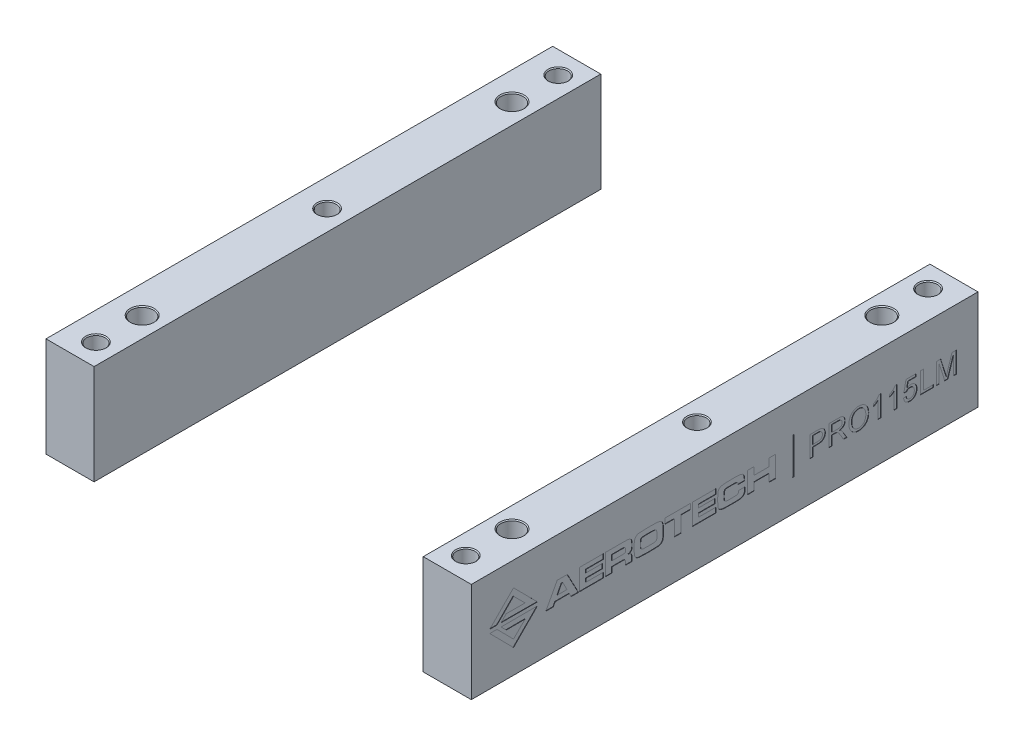
from build123d import *

# Parameters (mm, degrees)
SKETCH1_W                      = 13
SKETCH1_H                      = 27
EXTRUDE1_DEPTH                 = 68.5
EXTRUDE1_2_DEPTH               = 68.5
M5X0_8_TAPPED_HOLE1_AT_2_COUNT = 2
M5X0_8_TAPPED_HOLE1_AT_2_PITCH = 100
M5X0_8_TAPPED_HOLE1_AT_3_COUNT = 2
M5X0_8_TAPPED_HOLE1_AT_3_PITCH = 117.924764151
M5X0_8_TAPPED_HOLE1_AT_4_COUNT = 2
M5X0_8_TAPPED_HOLE1_AT_4_PITCH = 62.5
M5X0_8_TAPPED_HOLE1_AT_5_COUNT = 2
M5X0_8_TAPPED_HOLE1_AT_5_PITCH = 125
M5X0_8_TAPPED_HOLE1_AT_6_COUNT = 2
M5X0_8_TAPPED_HOLE1_AT_6_PITCH = 160.078105936
M6X1_0_TAPPED_HOLE1_AT_2_COUNT = 2
M6X1_0_TAPPED_HOLE1_AT_2_PITCH = 100
M6X1_0_TAPPED_HOLE1_AT_3_COUNT = 2
M6X1_0_TAPPED_HOLE1_AT_3_PITCH = 141.421356237
M6X1_0_TAPPED_HOLE1_AT_4_COUNT = 2
M6X1_0_TAPPED_HOLE1_AT_4_PITCH = 100
SKETCH8_W                      = 0.352777768
SKETCH8_H                      = 9.877777778
CUT_EXTRUDE1_DEPTH             = 0.1


with BuildPart() as part:
    # Sketch1 → Extrude1 (new, symmetric)
    with BuildSketch(Plane.XY):
        with Locations((-51, -23.5)):
            Rectangle(SKETCH1_W, SKETCH1_H)
    extrude(amount=EXTRUDE1_DEPTH, both=True)

    # Sketch3 → M5x0.8 Tapped Hole1 (revolve, cut)
    with BuildSketch(Plane(origin=(-50, -10, -62.5), x_dir=(0, 0, 1), z_dir=(1, 0, 0))):
        Polygon((0, 0), (0, 9.4618073), (2.1, 8.2), (2.1, 5.8), (2.5, 5.8), (2.5, 0.25), (2.75, 0), align=None)
    m5x0_8_tapped_hole1 = revolve(axis=Axis((-50, -3.65, -62.5), (0, -1, 0)), mode=Mode.SUBTRACT)

    # M5x0.8 Tapped Hole1 at 4: M5x0.8 Tapped Hole1 ×2
    with Locations(*[(0, 0, i * M5X0_8_TAPPED_HOLE1_AT_4_PITCH) for i in range(1, M5X0_8_TAPPED_HOLE1_AT_4_COUNT)]):
        add(m5x0_8_tapped_hole1, mode=Mode.SUBTRACT)

    # M5x0.8 Tapped Hole1 at 5: M5x0.8 Tapped Hole1 ×2
    with Locations(*[(0, 0, i * M5X0_8_TAPPED_HOLE1_AT_5_PITCH) for i in range(1, M5X0_8_TAPPED_HOLE1_AT_5_COUNT)]):
        add(m5x0_8_tapped_hole1, mode=Mode.SUBTRACT)

    # Sketch5 → M6x1.0 Tapped Hole1 (revolve, cut)
    with BuildSketch(Plane(origin=(-50, -10, -50), x_dir=(0, 0, 1), z_dir=(1, 0, 0))):
        Polygon((0, 0), (0, 11.502151548), (2.5, 10), (2.5, 7), (3, 7), (3, 0.25), (3.25, 0), align=None)
    m6x1_0_tapped_hole1 = revolve(axis=Axis((-50, -3.65, -50), (0, -1, 0)), mode=Mode.SUBTRACT)

    # M6x1.0 Tapped Hole1 at 4: M6x1.0 Tapped Hole1 ×2
    with Locations(*[(0, 0, i * M6X1_0_TAPPED_HOLE1_AT_4_PITCH) for i in range(1, M6X1_0_TAPPED_HOLE1_AT_4_COUNT)]):
        add(m6x1_0_tapped_hole1, mode=Mode.SUBTRACT)


with BuildPart() as body_2:
    # Sketch1 → Extrude1 2 (new, symmetric)
    with BuildSketch(Plane.XY):
        with Locations((51, -23.5)):
            Rectangle(SKETCH1_W, SKETCH1_H)
    extrude(amount=EXTRUDE1_2_DEPTH, both=True)

    # M5x0.8 Tapped Hole1 at 2: M5x0.8 Tapped Hole1 ×2
    with Locations(*[(i * M5X0_8_TAPPED_HOLE1_AT_2_PITCH, 0, 0) for i in range(1, M5X0_8_TAPPED_HOLE1_AT_2_COUNT)]):
        add(m5x0_8_tapped_hole1, mode=Mode.SUBTRACT)

    # M5x0.8 Tapped Hole1 at 3: M5x0.8 Tapped Hole1 ×2
    with Locations(*[Vector(0.847998304005088, 0, 0.5299989400031799) * (i * M5X0_8_TAPPED_HOLE1_AT_3_PITCH) for i in range(1, M5X0_8_TAPPED_HOLE1_AT_3_COUNT)]):
        add(m5x0_8_tapped_hole1, mode=Mode.SUBTRACT)

    # M5x0.8 Tapped Hole1 at 6: M5x0.8 Tapped Hole1 ×2
    with Locations(*[Vector(0.6246950475544243, 0, 0.7808688094430304) * (i * M5X0_8_TAPPED_HOLE1_AT_6_PITCH) for i in range(1, M5X0_8_TAPPED_HOLE1_AT_6_COUNT)]):
        add(m5x0_8_tapped_hole1, mode=Mode.SUBTRACT)

    # M6x1.0 Tapped Hole1 at 2: M6x1.0 Tapped Hole1 ×2
    with Locations(*[(i * M6X1_0_TAPPED_HOLE1_AT_2_PITCH, 0, 0) for i in range(1, M6X1_0_TAPPED_HOLE1_AT_2_COUNT)]):
        add(m6x1_0_tapped_hole1, mode=Mode.SUBTRACT)

    # M6x1.0 Tapped Hole1 at 3: M6x1.0 Tapped Hole1 ×2
    with Locations(*[Vector(0.7071067811865476, 0, 0.7071067811865476) * (i * M6X1_0_TAPPED_HOLE1_AT_3_PITCH) for i in range(1, M6X1_0_TAPPED_HOLE1_AT_3_COUNT)]):
        add(m6x1_0_tapped_hole1, mode=Mode.SUBTRACT)

    # Sketch8 → Cut-Extrude1 (cut)
    # profile 1 of 19: a face of its own
    with BuildSketch(Plane(origin=(57.5, 0, 0), x_dir=(0, 0, -1), z_dir=(1, 0, 0))):
        with BuildLine():
            Line((23.025857141, -26.353231317), (23.025857141, -20.70293021))
            Line((23.025857141, -20.70293021), (25.101708949, -20.70293021))
            add(Edge.make_bspline(
                [(25.101708949, -20.70293021), (25.187751334, -20.703420401), (25.349339335, -20.704340981), (25.574994903, -20.715122157), (25.768769004, -20.728460256), (25.885809339, -20.747450241), (25.939293649, -20.756128157)],
                knots=[0, 0, 0, 0, 1.22865052, 2.30741144, 3.226532197, 4, 4, 4, 4], degree=3))
            add(Edge.make_bspline(
                [(25.939293649, -20.756128157), (26.004531595, -20.768683346), (26.130980921, -20.793018801), (26.310013567, -20.851686305), (26.473122678, -20.924693536), (26.620053347, -21.015653011), (26.753246546, -21.122508146), (26.87080412, -21.250545682), (26.975010036, -21.396906765), (27.063616896, -21.561476877), (27.137368531, -21.738554246), (27.189024464, -21.927202917), (27.222110181, -22.124145375), (27.225592673, -22.258740394), (27.227363092, -22.327165404)],
                knots=[0, 0, 0, 0, 1.070909925, 2.075721949, 3.031861647, 3.947440733, 4.85625699, 5.777986723, 6.742441087, 7.747548058, 8.78749499, 9.830146138, 10.896896232, 12, 12, 12, 12], degree=3))
            add(Edge.make_bspline(
                [(27.227363092, -22.327165404), (27.226115405, -22.385709817), (27.223660512, -22.500899157), (27.202580736, -22.670128921), (27.169333372, -22.832934836), (27.119740419, -22.988202793), (27.059111703, -23.137748029), (26.982705511, -23.279048428), (26.893484636, -23.414022729), (26.791120604, -23.542303655), (26.670609708, -23.661288096), (26.525620286, -23.762223001), (26.358947747, -23.846979948), (26.170553219, -23.915462645), (25.960894032, -23.969347492), (25.729283232, -24.008828152), (25.475269635, -24.030624763), (25.298695381, -24.033608928), (25.206972972, -24.035159068)],
                knots=[0, 0, 0, 0, 0.928769099, 1.82740408, 2.702266355, 3.562020322, 4.410419678, 5.259600434, 6.10654066, 6.975254961, 7.860221694, 8.783881459, 9.766664779, 10.81996744, 11.958551584, 13.197863772, 14.544415867, 16, 16, 16, 16], degree=3))
            Line((25.206972972, -24.035159068), (23.822694476, -24.035159068))
            Line((23.822694476, -24.035159068), (23.822694476, -26.353231317))
            Line((23.822694476, -26.353231317), (23.025857141, -26.353231317))
        make_face()
        with BuildLine():
            Line((23.822694476, -23.383201248), (25.185467419, -23.383201248))
            add(Edge.make_bspline(
                [(25.185467419, -23.383201248), (25.239820159, -23.382292449), (25.344525676, -23.380541733), (25.495820372, -23.368324286), (25.63467157, -23.347176448), (25.761464432, -23.317681405), (25.876360404, -23.281019913), (25.979153916, -23.234653217), (26.069314892, -23.17903373), (26.147440763, -23.114728221), (26.214503006, -23.042690361), (26.272610846, -22.964101033), (26.321982407, -22.878398625), (26.360683877, -22.785224567), (26.393469357, -22.686391276), (26.413933416, -22.579850919), (26.428162012, -22.467148488), (26.429726794, -22.389466487), (26.430525756, -22.349802828)],
                knots=[0, 0, 0, 0, 1.403696362, 2.704090955, 3.91683431, 5.027708188, 6.063065288, 7.026749679, 7.932587242, 8.790956304, 9.632005367, 10.468072405, 11.310475089, 12.179234342, 13.069796908, 13.994719932, 14.976123913, 16, 16, 16, 16], degree=3))
            add(Edge.make_bspline(
                [(26.430525756, -22.349802828), (26.42883784, -22.292284198), (26.425567246, -22.180833173), (26.392615206, -22.020458582), (26.340953368, -21.872269616), (26.26698882, -21.739071959), (26.177470201, -21.622222137), (26.072242963, -21.52661975), (25.954680718, -21.450189164), (25.866903155, -21.419926379), (25.822710914, -21.404690364)],
                knots=[0, 0, 0, 0, 1.143156811, 2.215038775, 3.243253804, 4.254666983, 5.233799895, 6.158487526, 7.072877374, 8, 8, 8, 8], degree=3))
            add(Edge.make_bspline(
                [(25.822710914, -21.404690364), (25.806526298, -21.400732867), (25.771356017, -21.392132957), (25.713096721, -21.382371928), (25.645577266, -21.373129101), (25.568468529, -21.366996915), (25.482473723, -21.360906875), (25.38732995, -21.358099518), (25.282820475, -21.355674762), (25.20999323, -21.355158286), (25.171884965, -21.35488803)],
                knots=[0, 0, 0, 0, 0.611063981, 1.327884044, 2.165719042, 3.110592661, 4.16481496, 5.328235826, 6.601947678, 8, 8, 8, 8], degree=3))
            Line((25.171884965, -21.35488803), (23.822694476, -21.35488803))
            Line((23.822694476, -21.35488803), (23.822694476, -23.383201248))
        make_face(mode=Mode.SUBTRACT)
    # profile 2 of 19: a face of its own
    with BuildSketch(Plane(origin=(57.5, 0, 0), x_dir=(0, 0, -1), z_dir=(1, 0, 0))):
        with BuildLine():
            Line((28.241519701, -26.353231317), (28.241519701, -20.70293021))
            Line((28.241519701, -20.70293021), (30.693152753, -20.70293021))
            add(Edge.make_bspline(
                [(30.693152753, -20.70293021), (30.750881205, -20.703382536), (30.862607866, -20.704257961), (31.024634593, -20.710454973), (31.1758703, -20.723814106), (31.316593059, -20.738260145), (31.446777866, -20.760432887), (31.566290415, -20.785864521), (31.675315226, -20.81612855), (31.774339705, -20.851872701), (31.86621283, -20.892311854), (31.951372277, -20.942207239), (32.033358015, -20.996881942), (32.109127267, -21.061116559), (32.180678454, -21.131447518), (32.24794526, -21.20883047), (32.309931855, -21.293936939), (32.386384896, -21.415741947), (32.468403421, -21.577960566), (32.536737735, -21.78556525), (32.580798479, -22.002727327), (32.585513104, -22.15113245), (32.587905167, -22.226428866)],
                knots=[0, 0, 0, 0, 1.242255013, 2.404239178, 3.487702428, 4.508875116, 5.447164253, 6.327763259, 7.137389581, 7.87956647, 8.591787438, 9.293660819, 10.000726923, 10.709654955, 11.427269343, 12.158170644, 12.913245971, 13.690346794, 15.251572448, 16.809945773, 18.381459854, 20, 20, 20, 20], degree=3))
            add(Edge.make_bspline(
                [(32.587905167, -22.226428866), (32.586799502, -22.27476245), (32.584615736, -22.370224592), (32.567887871, -22.510579494), (32.53762015, -22.644682958), (32.498807764, -22.77370944), (32.445685448, -22.89583084), (32.38414555, -23.013541524), (32.307906366, -23.123607667), (32.222548169, -23.228960153), (32.124665207, -23.327342613), (32.013396406, -23.41520565), (31.889844748, -23.494238627), (31.753428354, -23.562260995), (31.605717513, -23.624436669), (31.444858862, -23.674503517), (31.271501611, -23.715386937), (31.151322307, -23.735184267), (31.089307678, -23.745400037)],
                knots=[0, 0, 0, 0, 0.982609109, 1.940720374, 2.867584677, 3.775009516, 4.675469332, 5.571146231, 6.471115823, 7.392408543, 8.32534739, 9.286126426, 10.269214477, 11.301811357, 12.381622301, 13.524260118, 14.722474812, 16, 16, 16, 16], degree=3))
            add(Edge.make_bspline(
                [(31.089307678, -23.745400037), (31.134797758, -23.768380621), (31.221185056, -23.812021579), (31.340789341, -23.880450221), (31.442173753, -23.950367432), (31.50091088, -24.000374276), (31.52847371, -24.023840356)],
                knots=[0, 0, 0, 0, 1.172304973, 2.226249348, 3.167654437, 4, 4, 4, 4], degree=3))
            add(Edge.make_bspline(
                [(31.52847371, -24.023840356), (31.581850687, -24.076165392), (31.69149079, -24.183644733), (31.842579615, -24.366713537), (31.989065419, -24.570497206), (32.07806659, -24.717772355), (32.123837969, -24.793512782)],
                knots=[0, 0, 0, 0, 0.918110279, 1.885863737, 2.912745394, 4, 4, 4, 4], degree=3))
            Line((32.123837969, -24.793512782), (33.050840494, -26.353231317))
            Line((33.050840494, -26.353231317), (32.137420424, -26.353231317))
            Line((32.137420424, -26.353231317), (31.433396528, -25.160239056))
            add(Edge.make_bspline(
                [(31.433396528, -25.160239056), (31.408083365, -25.118381488), (31.359030611, -25.037268396), (31.288175666, -24.918806629), (31.218704722, -24.809743697), (31.15427161, -24.706962523), (31.092261525, -24.612329048), (31.033273632, -24.525514534), (30.978931301, -24.445380088), (30.9116213, -24.352082739), (30.833283638, -24.248848356), (30.741868961, -24.142536436), (30.654815085, -24.057775358), (30.547606631, -23.974658105), (30.41481274, -23.896915886), (30.301935427, -23.861195472), (30.247195494, -23.843872832)],
                knots=[0, 0, 0, 0, 1.130940588, 2.191577161, 3.191089816, 4.120344442, 4.99615009, 5.80661983, 6.546979556, 7.234477901, 8.466216387, 9.541989141, 10.473533583, 11.269175393, 12.675684693, 14, 14, 14, 14], degree=3))
            add(Edge.make_bspline(
                [(30.247195494, -23.843872832), (30.224228647, -23.839731129), (30.171794648, -23.830275497), (30.082761847, -23.824100009), (29.974887686, -23.817545554), (29.896709444, -23.817736529), (29.854436182, -23.817839795)],
                knots=[0, 0, 0, 0, 0.709978628, 1.620902492, 2.713552433, 4, 4, 4, 4], degree=3))
            Line((29.854436182, -23.817839795), (29.038357036, -23.817839795))
            Line((29.038357036, -23.817839795), (29.038357036, -26.353231317))
            Line((29.038357036, -26.353231317), (28.241519701, -26.353231317))
        make_face()
        with BuildLine():
            Line((29.038357036, -23.165881975), (30.551668851, -23.165881975))
            add(Edge.make_bspline(
                [(30.551668851, -23.165881975), (30.627552038, -23.16469471), (30.769408538, -23.162475231), (30.967772411, -23.143523209), (31.136822568, -23.113407641), (31.279900887, -23.069480559), (31.40010926, -23.008495181), (31.504656765, -22.934173103), (31.591537059, -22.841076962), (31.663812488, -22.736037789), (31.719993662, -22.620447421), (31.760520081, -22.499036687), (31.787045327, -22.372825966), (31.789715121, -22.286928696), (31.791067832, -22.243406934)],
                knots=[0, 0, 0, 0, 1.546323217, 2.890706218, 4.056530419, 5.041445823, 5.928701482, 6.793137403, 7.641659452, 8.509781392, 9.383301667, 10.251423607, 11.114044887, 12, 12, 12, 12], degree=3))
            add(Edge.make_bspline(
                [(31.791067832, -22.243406934), (31.790016156, -22.211690971), (31.787956232, -22.149568717), (31.777157428, -22.058390495), (31.756161989, -21.97175011), (31.728437564, -21.889189569), (31.691392106, -21.811313571), (31.647383612, -21.737518662), (31.594867894, -21.668213843), (31.534714161, -21.603188002), (31.465646743, -21.544020841), (31.386755515, -21.492972415), (31.298662687, -21.449592265), (31.201265864, -21.415162878), (31.094871866, -21.387624973), (30.978875014, -21.369304893), (30.853805788, -21.356048544), (30.767140066, -21.355282095), (30.722581405, -21.35488803)],
                knots=[0, 0, 0, 0, 0.965208469, 1.890559848, 2.786986821, 3.67262109, 4.535197034, 5.405224191, 6.282113641, 7.175449223, 8.095446547, 9.040936516, 10.026471658, 11.075712529, 12.17809725, 13.364958037, 14.645208957, 16, 16, 16, 16], degree=3))
            Line((30.722581405, -21.35488803), (29.038357036, -21.35488803))
            Line((29.038357036, -21.35488803), (29.038357036, -23.165881975))
        make_face(mode=Mode.SUBTRACT)
    # profile 3 of 19: a face of its own
    with BuildSketch(Plane(origin=(57.5, 0, 0), x_dir=(0, 0, -1), z_dir=(1, 0, 0))):
        with BuildLine():
            add(Edge.make_bspline(
                [(33.602061776, -23.602784264), (33.604025604, -23.489500597), (33.607852021, -23.268773116), (33.643604305, -22.947365463), (33.701656836, -22.644962905), (33.784648067, -22.361588999), (33.88983969, -22.096799698), (34.017720203, -21.849995427), (34.172136166, -21.623969832), (34.34681997, -21.416571296), (34.541933756, -21.233215789), (34.749674481, -21.070369829), (34.972636176, -20.934537046), (35.208758845, -20.822383948), (35.459045673, -20.736276046), (35.722793929, -20.67599268), (35.999721536, -20.637104051), (36.189008037, -20.632727006), (36.285728428, -20.630490452)],
                knots=[0, 0, 0, 0, 1.203621547, 2.345195544, 3.432004029, 4.472479546, 5.478447225, 6.455936844, 7.420185704, 8.381829745, 9.332027588, 10.260832629, 11.182364398, 12.100723901, 13.034044877, 13.989196293, 14.972532542, 16, 16, 16, 16], degree=3))
            add(Edge.make_bspline(
                [(36.285728428, -20.630490452), (36.349522172, -20.631604411), (36.476205009, -20.633816532), (36.663494276, -20.650647817), (36.845970869, -20.680688745), (37.023455092, -20.720946958), (37.196430059, -20.773763982), (37.364999068, -20.836112872), (37.527686484, -20.913371926), (37.685574625, -20.999871125), (37.836799737, -21.096624219), (37.978920718, -21.203507166), (38.111597145, -21.319711614), (38.236611221, -21.44332748), (38.349791402, -21.578526626), (38.45581345, -21.721190654), (38.551630758, -21.873849229), (38.637583309, -22.035251573), (38.714433623, -22.202904855), (38.780117057, -22.377503931), (38.836518223, -22.556954362), (38.883730757, -22.742318303), (38.917607024, -22.933532384), (38.944583062, -23.129772682), (38.958781296, -23.331680576), (38.961318918, -23.468072957), (38.962603852, -23.537135733)],
                knots=[0, 0, 0, 0, 1.034375294, 2.054082248, 3.045783978, 4.031219655, 5.002789406, 5.976610191, 6.94273282, 7.920236376, 8.894345378, 9.851183672, 10.800797181, 11.752517031, 12.698794154, 13.65688337, 14.632873302, 15.61821402, 16.620222298, 17.621258913, 18.640965868, 19.669244166, 20.720417492, 21.788124603, 22.880008887, 24, 24, 24, 24], degree=3))
            add(Edge.make_bspline(
                [(38.962603852, -23.537135733), (38.961426573, -23.607337356), (38.959100655, -23.746032766), (38.94336254, -23.950928321), (38.915689465, -24.14994175), (38.878985843, -24.343666475), (38.829804109, -24.531699201), (38.771359177, -24.714579029), (38.700666729, -24.891216691), (38.620827458, -25.062037919), (38.530489356, -25.22469333), (38.4308403, -25.37804556), (38.321809695, -25.52066012), (38.205053703, -25.654286526), (38.077845763, -25.776535289), (37.941752265, -25.888549523), (37.79729649, -25.991385652), (37.643993138, -26.08225855), (37.484593448, -26.161911891), (37.322251689, -26.232578755), (37.156847269, -26.292846269), (36.987814886, -26.341687098), (36.815615645, -26.378594745), (36.640734134, -26.40623158), (36.462597068, -26.422144964), (36.34272967, -26.424489665), (36.282332814, -26.425671075)],
                knots=[0, 0, 0, 0, 1.141429366, 2.255090526, 3.338676798, 4.407031443, 5.458968682, 6.496860253, 7.526652771, 8.550250826, 9.560787671, 10.54935636, 11.521089193, 12.477323897, 13.431786008, 14.386110112, 15.340986122, 16.312041, 17.28047646, 18.236612773, 19.189437236, 20.140779471, 21.09494583, 22.051062463, 23.018000708, 24, 24, 24, 24], degree=3))
            add(Edge.make_bspline(
                [(36.282332814, -26.425671075), (36.21739278, -26.424710279), (36.088762835, -26.422807183), (35.898644312, -26.403811041), (35.713255639, -26.374831765), (35.533135775, -26.332994445), (35.358530844, -26.278414706), (35.189234251, -26.212353116), (35.024650561, -26.135692569), (34.866821985, -26.046238022), (34.716285707, -25.946774181), (34.574500779, -25.837795477), (34.441545603, -25.720306245), (34.319553566, -25.592364529), (34.204573729, -25.458608265), (34.101203503, -25.314065815), (34.006066977, -25.162015252), (33.921979398, -25.000990874), (33.846018853, -24.835777714), (33.782020454, -24.666322926), (33.725778265, -24.495123822), (33.680987054, -24.321125203), (33.645293909, -24.144728445), (33.621292856, -23.966227064), (33.603959113, -23.785355214), (33.602697405, -23.6639475), (33.602061776, -23.602784264)],
                knots=[0, 0, 0, 0, 1.072727997, 2.12480551, 3.153819198, 4.171534612, 5.177148798, 6.173931848, 7.17235114, 8.174500385, 9.168706755, 10.151274001, 11.127173509, 12.097141049, 13.070188938, 14.039134204, 15.03036519, 16.031505612, 17.038625933, 18.033164522, 19.022845559, 20.014762458, 21.000193215, 21.994692725, 22.989758729, 24, 24, 24, 24], degree=3))
        make_face()
        with BuildLine():
            add(Edge.make_bspline(
                [(34.398899112, -23.611839233), (34.400120227, -23.693413695), (34.402501316, -23.852478138), (34.429742263, -24.084385637), (34.471076048, -24.303202172), (34.528050308, -24.509542015), (34.604637667, -24.701364493), (34.696207769, -24.880512836), (34.805843804, -25.045796167), (34.931126872, -25.196752123), (35.068923885, -25.332359642), (35.216173978, -25.450805597), (35.372910252, -25.549995706), (35.537395006, -25.631898315), (35.710809657, -25.69583077), (35.892634828, -25.740722529), (36.083004112, -25.76879868), (36.212812487, -25.772054654), (36.278937201, -25.773713255)],
                knots=[0, 0, 0, 0, 1.215430442, 2.370003584, 3.475209778, 4.53279855, 5.55522989, 6.548792651, 7.526809858, 8.505409025, 9.467826767, 10.404123909, 11.316848639, 12.227335424, 13.138360512, 14.065900994, 15.014765094, 16, 16, 16, 16], degree=3))
            add(Edge.make_bspline(
                [(36.278937201, -25.773713255), (36.346182731, -25.772030122), (36.47784929, -25.768734552), (36.671088649, -25.741148522), (36.854687672, -25.694184481), (37.030466154, -25.631664704), (37.195246189, -25.547148622), (37.352881511, -25.448180754), (37.499074962, -25.327244854), (37.637415176, -25.191397498), (37.76149703, -25.036982028), (37.871593553, -24.867802189), (37.96102822, -24.681320714), (38.038242983, -24.481645533), (38.094784083, -24.265002711), (38.136571421, -24.03385504), (38.161753355, -23.787458991), (38.164405142, -23.618312676), (38.165766516, -23.531476377)],
                knots=[0, 0, 0, 0, 0.976878588, 1.912725521, 2.8289017, 3.727303729, 4.617335839, 5.514666588, 6.426584173, 7.368641557, 8.327632997, 9.299405846, 10.294892156, 11.327373912, 12.405931897, 13.542618837, 14.738430195, 16, 16, 16, 16], degree=3))
            add(Edge.make_bspline(
                [(38.165766516, -23.531476377), (38.165285407, -23.475611555), (38.164341645, -23.36602499), (38.151843075, -23.204493139), (38.135721522, -23.047985854), (38.111176208, -22.896705084), (38.077349651, -22.751277319), (38.039875569, -22.610595413), (37.993015541, -22.475871686), (37.939846309, -22.346577802), (37.880350838, -22.223377532), (37.81324786, -22.107309504), (37.739317248, -21.998824963), (37.660553737, -21.895867154), (37.57259585, -21.802420965), (37.47967881, -21.714539185), (37.379692009, -21.634037471), (37.273633281, -21.560894796), (37.163007205, -21.495054861), (37.048041836, -21.43870442), (36.930568737, -21.389207636), (36.808621572, -21.351266275), (36.683884199, -21.320666009), (36.555852362, -21.297422258), (36.424050841, -21.285385562), (36.335174489, -21.2834344), (36.290255913, -21.282448272)],
                knots=[0, 0, 0, 0, 1.220438779, 2.394059227, 3.538503547, 4.658058814, 5.74010225, 6.800155734, 7.837851593, 8.854470756, 9.853724944, 10.825214244, 11.781044712, 12.72106398, 13.654479919, 14.581868691, 15.514082315, 16.456304431, 17.39516604, 18.324312202, 19.252140633, 20.177768678, 21.111585046, 22.057694709, 23.018348693, 24, 24, 24, 24], degree=3))
            add(Edge.make_bspline(
                [(36.290255913, -21.282448272), (36.226769633, -21.283709085), (36.10150413, -21.286196808), (35.917098396, -21.313851717), (35.739311275, -21.35517193), (35.56786686, -21.412939789), (35.404231488, -21.489433513), (35.247557378, -21.583242596), (35.096453819, -21.691812767), (34.953303498, -21.817789312), (34.819856087, -21.96250561), (34.707039689, -22.13312169), (34.611954946, -22.325564589), (34.532560938, -22.539346509), (34.472025345, -22.776123049), (34.430187678, -23.034875249), (34.403772229, -23.315875769), (34.400565011, -23.510662641), (34.398899112, -23.611839233)],
                knots=[0, 0, 0, 0, 0.895090134, 1.766112571, 2.624765742, 3.468151641, 4.313618154, 5.168136083, 6.041303099, 6.935189387, 7.854749729, 8.809996334, 9.809869957, 10.877771942, 12.021723904, 13.25217762, 14.572720513, 16, 16, 16, 16], degree=3))
        make_face(mode=Mode.SUBTRACT)
    # profile 4 of 19: a face of its own
    with BuildSketch(Plane(origin=(57.5, 0, 0), x_dir=(0, 0, -1), z_dir=(1, 0, 0))):
        with BuildLine():
            Line((42.222392952, -26.353231317), (41.497995374, -26.353231317))
            Line((41.497995374, -26.353231317), (41.497995374, -21.950252289))
            add(Edge.make_bspline(
                [(41.497995374, -21.950252289), (41.456284498, -21.990477298), (41.369593012, -22.07408057), (41.223050213, -22.192400077), (41.059489721, -22.312321913), (40.881035474, -22.427640165), (40.699131558, -22.536199863), (40.523344843, -22.633832621), (40.356610162, -22.716453623), (40.246781127, -22.761631113), (40.194079734, -22.783309504)],
                knots=[0, 0, 0, 0, 0.893362401, 1.856755847, 2.901947673, 4.020460078, 5.132200827, 6.168787962, 7.121294059, 8, 8, 8, 8], degree=3))
            Line((40.194079734, -22.783309504), (40.194079734, -22.115505487))
            add(Edge.make_bspline(
                [(40.194079734, -22.115505487), (40.284599823, -22.06888746), (40.463009558, -21.977006089), (40.715063934, -21.818314331), (40.950383809, -21.646285932), (41.165073705, -21.460958981), (41.357529517, -21.271521568), (41.519714824, -21.080371777), (41.655421169, -20.894516334), (41.723507613, -20.764902774), (41.756062011, -20.70293021)],
                knots=[0, 0, 0, 0, 1.141258006, 2.249351951, 3.335817539, 4.406819942, 5.426913362, 6.360259544, 7.215985427, 8, 8, 8, 8], degree=3))
            Line((41.756062011, -20.70293021), (42.222392952, -20.70293021))
            Line((42.222392952, -20.70293021), (42.222392952, -26.353231317))
        make_face()
    # profile 5 of 19: a face of its own
    with BuildSketch(Plane(origin=(57.5, 0, 0), x_dir=(0, 0, -1), z_dir=(1, 0, 0))):
        with BuildLine():
            Line((46.568778419, -26.353231317), (45.844380841, -26.353231317))
            Line((45.844380841, -26.353231317), (45.844380841, -21.950252289))
            add(Edge.make_bspline(
                [(45.844380841, -21.950252289), (45.802669964, -21.990477298), (45.715978478, -22.07408057), (45.56943568, -22.192400077), (45.405875188, -22.312321913), (45.227420941, -22.427640165), (45.045517025, -22.536199863), (44.869730309, -22.633832621), (44.702995629, -22.716453623), (44.593166594, -22.761631113), (44.540465201, -22.783309504)],
                knots=[0, 0, 0, 0, 0.893362401, 1.856755847, 2.901947673, 4.020460078, 5.132200827, 6.168787962, 7.121294059, 8, 8, 8, 8], degree=3))
            Line((44.540465201, -22.783309504), (44.540465201, -22.115505487))
            add(Edge.make_bspline(
                [(44.540465201, -22.115505487), (44.63098529, -22.06888746), (44.809395025, -21.977006089), (45.061449401, -21.818314331), (45.296769275, -21.646285932), (45.511459172, -21.460958981), (45.703914983, -21.271521568), (45.866100291, -21.080371777), (46.001806636, -20.894516334), (46.06989308, -20.764902774), (46.102447478, -20.70293021)],
                knots=[0, 0, 0, 0, 1.141258006, 2.249351951, 3.335817539, 4.406819942, 5.426913362, 6.360259544, 7.215985427, 8, 8, 8, 8], degree=3))
            Line((46.102447478, -20.70293021), (46.568778419, -20.70293021))
            Line((46.568778419, -20.70293021), (46.568778419, -26.353231317))
        make_face()
    # profile 6 of 19: a face of its own
    with BuildSketch(Plane(origin=(57.5, 0, 0), x_dir=(0, 0, -1), z_dir=(1, 0, 0))):
        with BuildLine():
            Line((48.379772363, -24.831996403), (49.104169941, -24.759556646))
            add(Edge.make_bspline(
                [(49.104169941, -24.759556646), (49.111342614, -24.800372474), (49.125294579, -24.879765607), (49.151881591, -24.994689522), (49.18641055, -25.101457051), (49.225207638, -25.200992862), (49.271324522, -25.292244489), (49.321292548, -25.376652747), (49.380219622, -25.451221406), (49.442173529, -25.519850476), (49.510172675, -25.580324825), (49.584873203, -25.631306787), (49.664190917, -25.675785462), (49.749091878, -25.712202625), (49.839706206, -25.73885807), (49.934880624, -25.759937952), (50.035840674, -25.770560004), (50.104725027, -25.77264873), (50.139832103, -25.773713255)],
                knots=[0, 0, 0, 0, 1.237781394, 2.407677316, 3.51963579, 4.58689595, 5.594855907, 6.570874, 7.510833816, 8.428091223, 9.330271693, 10.221190844, 11.124215526, 12.043132878, 12.973586933, 13.941700858, 14.950982896, 16, 16, 16, 16], degree=3))
            add(Edge.make_bspline(
                [(50.139832103, -25.773713255), (50.182900621, -25.772672594), (50.267122983, -25.770637537), (50.389650566, -25.753425845), (50.505387792, -25.725045758), (50.613780875, -25.685329935), (50.716100514, -25.635938609), (50.808952318, -25.57198584), (50.897399079, -25.500096607), (50.975749227, -25.414390846), (51.047069874, -25.321085808), (51.108624955, -25.21923939), (51.160445637, -25.110281087), (51.204072986, -24.994231789), (51.2362886, -24.870428545), (51.259985787, -24.739529967), (51.275198434, -24.60145267), (51.276631031, -24.506812641), (51.277362674, -24.458478902)],
                knots=[0, 0, 0, 0, 1.052816602, 2.058828735, 3.018813999, 3.961574988, 4.877590722, 5.788574389, 6.712363302, 7.658909047, 8.620312049, 9.580784896, 10.562948504, 11.56722449, 12.607883026, 13.686460295, 14.818448981, 16, 16, 16, 16], degree=3))
            add(Edge.make_bspline(
                [(51.277362674, -24.458478902), (51.2765311, -24.412417479), (51.274911833, -24.322725206), (51.261274957, -24.192118343), (51.238267942, -24.069308367), (51.208499019, -23.952941696), (51.167466314, -23.844836705), (51.118799215, -23.743425975), (51.059179974, -23.650861742), (50.992849633, -23.56426189), (50.91709201, -23.486628612), (50.830883632, -23.421077141), (50.737606402, -23.363706367), (50.635381622, -23.317182247), (50.524149096, -23.282616575), (50.40501417, -23.2560214), (50.276740642, -23.242033428), (50.188531547, -23.239581191), (50.143227717, -23.238321732)],
                knots=[0, 0, 0, 0, 1.165854935, 2.270189951, 3.319242023, 4.32700288, 5.306253956, 6.24172124, 7.169108591, 8.088047231, 8.999810445, 9.905349262, 10.822648491, 11.767237767, 12.739852311, 13.766490849, 14.852878837, 16, 16, 16, 16], degree=3))
            add(Edge.make_bspline(
                [(50.143227717, -23.238321732), (50.086894602, -23.239969586), (49.978860437, -23.243129797), (49.823626452, -23.269715514), (49.682311335, -23.312661354), (49.556515051, -23.376666905), (49.444122287, -23.453132047), (49.342798145, -23.539655825), (49.251707103, -23.636179741), (49.201739958, -23.708851046), (49.176609699, -23.745400037)],
                knots=[0, 0, 0, 0, 1.182877094, 2.268490576, 3.298955169, 4.273890847, 5.221533034, 6.149304476, 7.069219215, 8, 8, 8, 8], degree=3))
            Line((49.176609699, -23.745400037), (48.452212121, -23.672960279))
            Line((48.452212121, -23.672960279), (49.031730183, -20.775369968))
            Line((49.031730183, -20.775369968), (51.712001221, -20.775369968))
            Line((51.712001221, -20.775369968), (51.712001221, -21.499767546))
            Line((51.712001221, -21.499767546), (49.623698829, -21.499767546))
            Line((49.623698829, -21.499767546), (49.33620354, -22.963277027))
            add(Edge.make_bspline(
                [(49.33620354, -22.963277027), (49.376173859, -22.93328274), (49.454669241, -22.874378705), (49.577107968, -22.797251635), (49.70129744, -22.732238658), (49.82651472, -22.678998496), (49.95375446, -22.637524504), (50.082248839, -22.60871029), (50.212435357, -22.589235948), (50.299733097, -22.587323987), (50.343568922, -22.586363912)],
                knots=[0, 0, 0, 0, 1.093835215, 2.148119334, 3.164235237, 4.159999629, 5.123971815, 6.089888814, 7.040853737, 8, 8, 8, 8], degree=3))
            add(Edge.make_bspline(
                [(50.343568922, -22.586363912), (50.400618277, -22.587858651), (50.512962293, -22.590802153), (50.678505091, -22.614986731), (50.836791853, -22.656041655), (50.989064168, -22.711336653), (51.133314146, -22.784639619), (51.271002938, -22.873393945), (51.401574644, -22.978331209), (51.524291107, -23.097471461), (51.635599819, -23.229729666), (51.735224749, -23.370792403), (51.81659295, -23.52348336), (51.885029192, -23.683815751), (51.93664527, -23.854421489), (51.975823676, -24.032879331), (51.996771069, -24.221420407), (52.000071163, -24.349772991), (52.001760252, -24.415467796)],
                knots=[0, 0, 0, 0, 0.991958705, 1.953407265, 2.902004973, 3.832128134, 4.765371166, 5.71007953, 6.676509202, 7.674246545, 8.68000108, 9.679398714, 10.671856529, 11.683459888, 12.706765812, 13.76733029, 14.85725088, 16, 16, 16, 16], degree=3))
            add(Edge.make_bspline(
                [(52.001760252, -24.415467796), (52.000477637, -24.478151441), (51.997944105, -24.601969525), (51.977181288, -24.784438362), (51.942979483, -24.960261449), (51.897192703, -25.129959451), (51.835328618, -25.292568616), (51.760293274, -25.448614185), (51.673735796, -25.599724439), (51.60432119, -25.69287519), (51.569385448, -25.739757118)],
                knots=[0, 0, 0, 0, 1.059692978, 2.093196008, 3.100373587, 4.086253034, 5.061402885, 6.037282833, 7.012182238, 8, 8, 8, 8], degree=3))
            add(Edge.make_bspline(
                [(51.569385448, -25.739757118), (51.525000567, -25.794483083), (51.437690742, -25.902134932), (51.286514732, -26.041860589), (51.123998378, -26.160608167), (50.949174526, -26.257081969), (50.763216824, -26.334606838), (50.563840832, -26.386196727), (50.353455668, -26.420841381), (50.209022171, -26.424039026), (50.135304618, -26.425671075)],
                knots=[0, 0, 0, 0, 1.023140956, 2.012628108, 2.982342558, 3.942221589, 4.908720554, 5.902469194, 6.929439212, 8, 8, 8, 8], degree=3))
            add(Edge.make_bspline(
                [(50.135304618, -26.425671075), (50.074499333, -26.424437649), (49.955551989, -26.422024822), (49.781391914, -26.401048843), (49.615745088, -26.367599552), (49.458559617, -26.319622915), (49.309361942, -26.258999943), (49.169886294, -26.181987982), (49.037712221, -26.093891096), (48.915747113, -25.991995035), (48.80462102, -25.878341753), (48.705049784, -25.755339319), (48.618380874, -25.622907526), (48.544656123, -25.481838816), (48.483209946, -25.332268478), (48.436201192, -25.173175638), (48.398966347, -25.006121241), (48.386237442, -24.890646597), (48.379772363, -24.831996403)],
                knots=[0, 0, 0, 0, 1.108768375, 2.168973506, 3.19473529, 4.187459816, 5.162590879, 6.12651078, 7.088512529, 8.056012598, 9.019588496, 9.983680353, 10.938070192, 11.90157236, 12.88306954, 13.882379887, 14.924449348, 16, 16, 16, 16], degree=3))
        make_face()
    # profile 7 of 19: a face of its own
    with BuildSketch(Plane(origin=(57.5, 0, 0), x_dir=(0, 0, -1), z_dir=(1, 0, 0))):
        Polygon((53.015916861, -26.353231317), (53.015916861, -20.70293021), (53.812754197, -20.70293021), (53.812754197, -25.701273497), (56.493025235, -25.701273497), (56.493025235, -26.353231317), align=None)
    # profile 8 of 19: a face of its own
    with BuildSketch(Plane(origin=(57.5, 0, 0), x_dir=(0, 0, -1), z_dir=(1, 0, 0))):
        with BuildLine():
            Line((57.217422812, -26.353231317), (57.217422812, -20.70293021))
            Line((57.217422812, -20.70293021), (58.416074429, -20.70293021))
            Line((58.416074429, -20.70293021), (59.679242706, -24.667875077))
            add(Edge.make_bspline(
                [(59.679242706, -24.667875077), (59.693143926, -24.712790993), (59.720028078, -24.799655759), (59.759894084, -24.925096473), (59.796165467, -25.0416655), (59.828833559, -25.149733885), (59.85966286, -25.248765072), (59.886356176, -25.339571685), (59.911875855, -25.421144662), (59.926831527, -25.472986956), (59.933913729, -25.497536678)],
                knots=[0, 0, 0, 0, 1.300204174, 2.514519184, 3.639827924, 4.676153899, 5.636536826, 6.507959918, 7.293450077, 8, 8, 8, 8], degree=3))
            add(Edge.make_bspline(
                [(59.933913729, -25.497536678), (59.941801657, -25.47073851), (59.958587673, -25.413710295), (59.985800488, -25.324043202), (60.014755698, -25.224816474), (60.049406209, -25.117735656), (60.085525266, -25.001120987), (60.123436917, -24.875069311), (60.167167268, -24.740839103), (60.196228272, -24.647909467), (60.211222177, -24.599962804)],
                knots=[0, 0, 0, 0, 0.713638162, 1.518667645, 2.393860736, 3.354087503, 4.393659122, 5.512594909, 6.716633584, 8, 8, 8, 8], degree=3))
            Line((60.211222177, -24.599962804), (61.46193987, -20.70293021))
            Line((61.46193987, -20.70293021), (62.650404646, -20.70293021))
            Line((62.650404646, -20.70293021), (62.650404646, -26.353231317))
            Line((62.650404646, -26.353231317), (61.85356731, -26.353231317))
            Line((61.85356731, -26.353231317), (61.85356731, -21.572207303))
            Line((61.85356731, -21.572207303), (60.345914851, -26.353231317))
            Line((60.345914851, -26.353231317), (59.512857637, -26.353231317))
            Line((59.512857637, -26.353231317), (58.014260148, -21.572207303))
            Line((58.014260148, -21.572207303), (58.014260148, -26.353231317))
            Line((58.014260148, -26.353231317), (57.217422812, -26.353231317))
        make_face()
    # profile 9 of 19: a face of its own
    with BuildSketch(Plane(origin=(57.5, 0, 0), x_dir=(0, 0, -1), z_dir=(1, 0, 0))):
        Polygon((-57.087311551, -30.495089268), (-50.630349492, -23.971275821), (-60.451964799, -24.001085543), (-59.049990668, -25.410291618), (-53.951258297, -25.38789023), (-57.094543495, -28.509514873), (-61.567130604, -24.001085543), (-63.5, -24.008317487), align=None)
    # profile 10 of 19: a face of its own
    with BuildSketch(Plane(origin=(57.5, 0, 0), x_dir=(0, 0, -1), z_dir=(1, 0, 0))):
        Polygon((-57.087311551, -16.504910732), (-50.630349492, -23.028512512), (-60.451964799, -22.998561679), (-59.049990668, -21.589320326), (-53.951258297, -21.611898103), (-57.094543495, -18.490304361), (-61.567130604, -22.998561679), (-63.5, -22.991506124), align=None)
    # profile 11 of 19: a face of its own
    with BuildSketch(Plane(origin=(57.5, 0, 0), x_dir=(0, 0, -1), z_dir=(1, 0, 0))):
        Polygon((-41.513936944, -26.353231317), (-42.010013043, -25.389618841), (-45.83821628, -25.389618841), (-46.334292378, -26.353231317), (-48.347983161, -26.353231317), (-45.278746016, -20.646945072), (-42.539885252, -20.646945072), (-39.512840328, -26.353231317), align=None)
        Polygon((-42.628749972, -24.136975539), (-43.74394941, -21.974337694), (-44.095668855, -21.974337694), (-45.210871573, -24.136975539), align=None, mode=Mode.SUBTRACT)
    # profile 12 of 19: a face of its own
    with BuildSketch(Plane(origin=(57.5, 0, 0), x_dir=(0, 0, -1), z_dir=(1, 0, 0))):
        Polygon((-39.228783669, -20.646945072), (-32.815742442, -20.646945072), (-32.815742442, -21.984995872), (-37.494351768, -21.984995872), (-37.494351768, -22.80940224), (-33.051397991, -22.80940224), (-33.051397991, -24.061869152), (-37.494351768, -24.061869152), (-37.494351768, -24.993625796), (-32.783533832, -24.993625796), (-32.783533832, -26.353231317), (-39.228783669, -26.353231317), align=None)
    # profile 13 of 19: a face of its own
    with BuildSketch(Plane(origin=(57.5, 0, 0), x_dir=(0, 0, -1), z_dir=(1, 0, 0))):
        with BuildLine():
            Line((-32.207165513, -26.353231317), (-32.207165513, -20.646945072))
            Line((-32.207165513, -20.646945072), (-27.94472812, -20.646945072))
            add(Edge.make_bspline(
                [(-27.94472812, -20.646945072), (-26.94548509, -20.64952035), (-26.347066077, -20.659503961), (-26.149510522, -20.676543127)],
                knots=[2, 2, 2, 2, 3, 3, 3, 3], degree=3))
            add(Edge.make_bspline(
                [(-26.149510522, -20.676543127), (-25.951745393, -20.693617571), (-25.761421787, -20.758740347), (-25.577624569, -20.872052566)],
                knots=[3, 3, 3, 3, 4, 4, 4, 4], degree=3))
            add(Edge.make_bspline(
                [(-25.577624569, -20.872052566), (-25.357632352, -21.002298119), (-25.206749301, -21.182990892), (-25.124763747, -21.413989775)],
                knots=[4, 4, 4, 4, 5, 5, 5, 5], degree=3))
            add(Edge.make_bspline(
                [(-25.124763747, -21.413989775), (-25.042919305, -21.644812269), (-25.00192441, -22.007044482), (-25.00192441, -22.499875025)],
                knots=[5, 5, 5, 5, 6, 6, 6, 6], degree=3))
            add(Edge.make_bspline(
                [(-25.00192441, -22.499875025), (-25.00192441, -22.916399737), (-25.027961527, -23.222646118), (-25.080137359, -23.418155558)],
                knots=[6, 6, 6, 6, 7, 7, 7, 7], degree=3))
            add(Edge.make_bspline(
                [(-25.080137359, -23.418155558), (-25.132348469, -23.613664997), (-25.230702911, -23.771109715), (-25.374530408, -23.890136935)],
                knots=[7, 7, 7, 7, 8, 8, 8, 8], degree=3))
            add(Edge.make_bspline(
                [(-25.374530408, -23.890136935), (-25.529540959, -24.014349987), (-25.764173453, -24.100815818), (-26.077334279, -24.149040539)],
                knots=[8, 8, 8, 8, 9, 9, 9, 9], degree=3))
            add(Edge.make_bspline(
                [(-26.077334279, -24.149040539), (-25.708011232, -24.177650816), (-25.44272235, -24.281857138), (-25.282029966, -24.462024976)],
                knots=[9, 9, 9, 9, 10, 10, 10, 10], degree=3))
            add(Edge.make_bspline(
                [(-25.282029966, -24.462024976), (-25.18882819, -24.569692751), (-25.129561525, -24.70078497), (-25.104443748, -24.85597191)],
                knots=[10, 10, 10, 10, 11, 11, 11, 11], degree=3))
            add(Edge.make_bspline(
                [(-25.104443748, -24.85597191), (-25.078937915, -25.01101774), (-25.066202638, -25.333985787), (-25.066202638, -25.824734941)],
                knots=[11, 11, 11, 11, 12, 12, 12, 12], degree=3))
            Line((-25.066202638, -25.824734941), (-25.066202638, -26.353231317))
            Line((-25.066202638, -26.353231317), (-26.800458149, -26.353231317))
            Line((-26.800458149, -26.353231317), (-26.800458149, -26.053476047))
            add(Edge.make_bspline(
                [(-26.800458149, -26.053476047), (-26.800458149, -25.734988277), (-26.812487871, -25.508112694), (-26.836617871, -25.372897175)],
                knots=[15, 15, 15, 15, 16, 16, 16, 16], degree=3))
            add(Edge.make_bspline(
                [(-26.836617871, -25.372897175), (-26.86074787, -25.237677456), (-26.90502148, -25.134521027), (-26.969932589, -25.064393016)],
                knots=[16, 16, 16, 16, 17, 17, 17, 17], degree=3))
            add(Edge.make_bspline(
                [(-26.969932589, -25.064393016), (-27.035055366, -24.996871351), (-27.12480203, -24.953832463), (-27.239172583, -24.935382186)],
                knots=[17, 17, 17, 17, 18, 18, 18, 18], degree=3))
            add(Edge.make_bspline(
                [(-27.239172583, -24.935382186), (-27.353541077, -24.917143575), (-27.593149796, -24.907830242), (-27.957496633, -24.907830242)],
                knots=[18, 18, 18, 18, 19, 19, 19, 19], degree=3))
            Line((-27.957496633, -24.907830242), (-30.440525002, -24.907830242))
            Line((-30.440525002, -24.907830242), (-30.440525002, -26.353231317))
            Line((-30.440525002, -26.353231317), (-32.207165513, -26.353231317))
        make_face()
        with BuildLine():
            Line((-30.440525002, -23.483983889), (-27.961802564, -23.483983889))
            add(Edge.make_bspline(
                [(-27.961802564, -23.483983889), (-27.534094797, -23.475340834), (-27.279142304, -23.467615001), (-27.196451195, -23.460383057)],
                knots=[1, 1, 1, 1, 2, 2, 2, 2], degree=3))
            add(Edge.make_bspline(
                [(-27.196451195, -23.460383057), (-27.113936475, -23.453468612), (-27.043486754, -23.431420002), (-26.984572867, -23.394237225)],
                knots=[2, 2, 2, 2, 3, 3, 3, 3], degree=3))
            add(Edge.make_bspline(
                [(-26.984572867, -23.394237225), (-26.90914898, -23.348759916), (-26.856267592, -23.279161117), (-26.825432744, -23.185110564)],
                knots=[3, 3, 3, 3, 4, 4, 4, 4], degree=3))
            add(Edge.make_bspline(
                [(-26.825432744, -23.185110564), (-26.794602038, -23.09106001), (-26.779079817, -22.948784736), (-26.779079817, -22.758073074)],
                knots=[4, 4, 4, 4, 5, 5, 5, 5], degree=3))
            add(Edge.make_bspline(
                [(-26.779079817, -22.758073074), (-26.779079817, -22.56739669), (-26.796824538, -22.425791694), (-26.831782744, -22.333293363)],
                knots=[5, 5, 5, 5, 6, 6, 6, 6], degree=3))
            add(Edge.make_bspline(
                [(-26.831782744, -22.333293363), (-26.866603981, -22.240795032), (-26.927211202, -22.174472811), (-27.014029811, -22.134679479)],
                knots=[6, 6, 6, 6, 7, 7, 7, 7], degree=3))
            add(Edge.make_bspline(
                [(-27.014029811, -22.134679479), (-27.075695365, -22.106276583), (-27.148929966, -22.089206425), (-27.234198416, -22.083526702)],
                knots=[7, 7, 7, 7, 8, 8, 8, 8], degree=3))
            add(Edge.make_bspline(
                [(-27.234198416, -22.083526702), (-27.319605914, -22.078023369), (-27.563551741, -22.07371948), (-27.965930064, -22.070615036)],
                knots=[8, 8, 8, 8, 9, 9, 9, 9], degree=3))
            Line((-27.965930064, -22.070615036), (-30.440525002, -22.070615036))
            Line((-30.440525002, -22.070615036), (-30.440525002, -23.483983889))
        make_face(mode=Mode.SUBTRACT)
    # profile 14 of 19: a face of its own
    with BuildSketch(Plane(origin=(57.5, 0, 0), x_dir=(0, 0, -1), z_dir=(1, 0, 0))):
        Polygon((-16.17369814, -20.646945072), (-9.171200539, -20.646945072), (-9.171200539, -22.102823646), (-11.741080752, -22.102823646), (-11.741080752, -26.353231317), (-13.593164039, -26.353231317), (-13.593164039, -22.102823646), (-16.17369814, -22.102823646), align=None)
    # profile 15 of 19: a face of its own
    with BuildSketch(Plane(origin=(57.5, 0, 0), x_dir=(0, 0, -1), z_dir=(1, 0, 0))):
        Polygon((-8.762613327, -20.646945072), (-2.349748489, -20.646945072), (-2.349748489, -21.984995872), (-7.028357815, -21.984995872), (-7.028357815, -22.80940224), (-2.585404039, -22.80940224), (-2.585404039, -24.061869152), (-7.028357815, -24.061869152), (-7.028357815, -24.993625796), (-2.317716268, -24.993625796), (-2.317716268, -26.353231317), (-8.762613327, -26.353231317), align=None)
    # profile 16 of 19: a face of its own
    with BuildSketch(Plane(origin=(57.5, 0, 0), x_dir=(0, 0, -1), z_dir=(1, 0, 0))):
        with BuildLine():
            Line((3.735668024, -24.147664706), (5.499556868, -24.147664706))
            add(Edge.make_bspline(
                [(5.499556868, -24.147664706), (5.508164646, -24.425336088), (5.512647812, -24.605534972), (5.512647812, -24.687696914)],
                knots=[1, 1, 1, 1, 2, 2, 2, 2], degree=3))
            add(Edge.make_bspline(
                [(5.512647812, -24.687696914), (5.512647812, -25.129692181), (5.446146314, -25.475238006), (5.313537151, -25.724651888)],
                knots=[2, 2, 2, 2, 3, 3, 3, 3], degree=3))
            add(Edge.make_bspline(
                [(5.313537151, -25.724651888), (5.166781599, -26.002499659), (4.879796884, -26.190777154), (4.452935783, -26.290154652)],
                knots=[3, 3, 3, 3, 4, 4, 4, 4], degree=3))
            add(Edge.make_bspline(
                [(4.452935783, -26.290154652), (4.026780239, -26.389214649), (3.289862757, -26.438638815), (2.241865839, -26.438638815)],
                knots=[4, 4, 4, 4, 5, 5, 5, 5], degree=3))
            add(Edge.make_bspline(
                [(2.241865839, -26.438638815), (1.140140867, -26.438638815), (0.354998665, -26.418671593), (-0.112149657, -26.379583816)],
                knots=[5, 5, 5, 5, 6, 6, 6, 6], degree=3))
            add(Edge.make_bspline(
                [(-0.112149657, -26.379583816), (-0.579650756, -26.340107984), (-0.931758247, -26.259498264), (-1.169459908, -26.137719378)],
                knots=[6, 6, 6, 6, 7, 7, 7, 7], degree=3))
            add(Edge.make_bspline(
                [(-1.169459908, -26.137719378), (-1.381335522, -26.030576583), (-1.539453232, -25.884671884), (-1.643840174, -25.701227444)],
                knots=[7, 7, 7, 7, 8, 8, 8, 8], degree=3))
            add(Edge.make_bspline(
                [(-1.643840174, -25.701227444), (-1.74822441, -25.517430227), (-1.816101558, -25.264382733), (-1.847110724, -24.942120241)],
                knots=[8, 8, 8, 8, 9, 9, 9, 9], degree=3))
            add(Edge.make_bspline(
                [(-1.847110724, -24.942120241), (-1.872934057, -24.684768859), (-1.884999057, -24.216738593), (-1.884999057, -23.538064721)],
                knots=[9, 9, 9, 9, 10, 10, 10, 10], degree=3))
            add(Edge.make_bspline(
                [(-1.884999057, -23.538064721), (-1.884999057, -22.876782794), (-1.872934057, -22.399615583), (-1.847110724, -22.106951146)],
                knots=[10, 10, 10, 10, 11, 11, 11, 11], degree=3))
            add(Edge.make_bspline(
                [(-1.847110724, -22.106951146), (-1.821954966, -21.814286709), (-1.772357115, -21.587626993), (-1.698626561, -21.426372275)],
                knots=[11, 11, 11, 11, 12, 12, 12, 12], degree=3))
            add(Edge.make_bspline(
                [(-1.698626561, -21.426372275), (-1.537724621, -21.064492839), (-1.211828518, -20.829860345), (-0.720550197, -20.72219257)],
                knots=[12, 12, 12, 12, 13, 13, 13, 13], degree=3))
            add(Edge.make_bspline(
                [(-0.720550197, -20.72219257), (-0.228954376, -20.615053962), (0.762210043, -20.561149519), (2.253930839, -20.561149519)],
                knots=[13, 13, 13, 13, 14, 14, 14, 14], degree=3))
            add(Edge.make_bspline(
                [(2.253930839, -20.561149519), (2.998753367, -20.561149519), (3.541710806, -20.577337694), (3.880697812, -20.609727017)],
                knots=[14, 14, 14, 14, 15, 15, 15, 15], degree=3))
            add(Edge.make_bspline(
                [(3.880697812, -20.609727017), (4.219364478, -20.642112017), (4.488778005, -20.705153404), (4.689617256, -20.79835729)],
                knots=[15, 15, 15, 15, 16, 16, 16, 16], degree=3))
            add(Edge.make_bspline(
                [(4.689617256, -20.79835729), (4.952469104, -20.919783399), (5.137148266, -21.101322838), (5.244639652, -21.34265811)],
                knots=[16, 16, 16, 16, 17, 17, 17, 17], degree=3))
            add(Edge.make_bspline(
                [(5.244639652, -21.34265811), (5.351781145, -21.583993382), (5.405859093, -21.939170039), (5.405859093, -22.407901583)],
                knots=[17, 17, 17, 17, 18, 18, 18, 18], degree=3))
            add(Edge.make_bspline(
                [(5.405859093, -22.407901583), (5.405859093, -22.433376416), (5.405859093, -22.527779747), (5.40621187, -22.691609743)],
                knots=[18, 18, 18, 18, 19, 19, 19, 19], degree=3))
            Line((5.40621187, -22.691609743), (3.642640526, -22.691609743))
            add(Edge.make_bspline(
                [(3.642640526, -22.691609743), (3.634032748, -22.502626692), (3.621967749, -22.375838362), (3.606480805, -22.310927252)],
                knots=[20, 20, 20, 20, 21, 21, 21, 21], degree=3))
            add(Edge.make_bspline(
                [(3.606480805, -22.310927252), (3.590993861, -22.245976583), (3.559279139, -22.193765472), (3.511407196, -22.154152812)],
                knots=[21, 21, 21, 21, 22, 22, 22, 22], degree=3))
            add(Edge.make_bspline(
                [(3.511407196, -22.154152812), (3.443179976, -22.095062535), (3.272647202, -22.052023648), (2.998753367, -22.025137694)],
                knots=[22, 22, 22, 22, 23, 23, 23, 23], degree=3))
            add(Edge.make_bspline(
                [(2.998753367, -22.025137694), (2.724536383, -21.998613093), (2.309740282, -21.984995872), (1.753374463, -21.984995872)],
                knots=[23, 23, 23, 23, 24, 24, 24, 24], degree=3))
            add(Edge.make_bspline(
                [(1.753374463, -21.984995872), (1.202511977, -21.984995872), (0.821476708, -21.997060871), (0.609951158, -22.021014482)],
                knots=[24, 24, 24, 24, 25, 25, 25, 25], degree=3))
            add(Edge.make_bspline(
                [(0.609951158, -22.021014482), (0.39807559, -22.045285592), (0.248530334, -22.091107138), (0.161041447, -22.158985867)],
                knots=[25, 25, 25, 25, 26, 26, 26, 26], degree=3))
            add(Edge.make_bspline(
                [(0.161041447, -22.158985867), (0.056301728, -22.244075865), (-0.01672327, -22.385323805), (-0.057360522, -22.583412801)],
                knots=[26, 26, 26, 26, 27, 27, 27, 27], degree=3))
            add(Edge.make_bspline(
                [(-0.057360522, -22.583412801), (-0.098038546, -22.781356407), (-0.118711323, -23.096916121), (-0.118711323, -23.529598055)],
                knots=[27, 27, 27, 27, 28, 28, 28, 28], degree=3))
            add(Edge.make_bspline(
                [(-0.118711323, -23.529598055), (-0.118711323, -23.962668044), (-0.100437435, -24.26739325), (-0.063924936, -24.444103865)],
                knots=[28, 28, 28, 28, 29, 29, 29, 29], degree=3))
            add(Edge.make_bspline(
                [(-0.063924936, -24.444103865), (-0.026706881, -24.621021916), (0.043919228, -24.749362468), (0.147956145, -24.828243578)],
                knots=[29, 29, 29, 29, 30, 30, 30, 30], degree=3))
            add(Edge.make_bspline(
                [(0.147956145, -24.828243578), (0.246484223, -24.901974131), (0.404599219, -24.951221908), (0.620605047, -24.97672774)],
                knots=[30, 30, 30, 30, 31, 31, 31, 31], degree=3))
            add(Edge.make_bspline(
                [(0.620605047, -24.97672774), (0.835940597, -25.002229361), (1.218351698, -25.014792462), (1.76610974, -25.014792462)],
                knots=[31, 31, 31, 31, 32, 32, 32, 32], degree=3))
            add(Edge.make_bspline(
                [(1.76610974, -25.014792462), (2.441011701, -25.014792462), (2.890588878, -25.003433018), (3.115555262, -24.98085524)],
                knots=[32, 32, 32, 32, 33, 33, 33, 33], degree=3))
            add(Edge.make_bspline(
                [(3.115555262, -24.98085524), (3.339816089, -24.957959963), (3.491404697, -24.909558853), (3.570638583, -24.835651911)],
                knots=[33, 33, 33, 33, 34, 34, 34, 34], degree=3))
            add(Edge.make_bspline(
                [(3.570638583, -24.835651911), (3.675381145, -24.735921635), (3.729811913, -24.506651363), (3.735668024, -24.147664706)],
                knots=[34, 34, 34, 34, 35, 35, 35, 35], degree=3))
        make_face()
    # profile 17 of 19: a face of its own
    with BuildSketch(Plane(origin=(57.5, 0, 0), x_dir=(0, 0, -1), z_dir=(1, 0, 0))):
        Polygon((6.126901574, -20.646945072), (7.979337639, -20.646945072), (7.979337639, -22.691609743), (11.961881149, -22.691609743), (11.961881149, -20.646945072), (13.814317214, -20.646945072), (13.814317214, -26.353231317), (11.961881149, -26.353231317), (11.961881149, -24.286835536), (7.979337639, -24.286835536), (7.979337639, -26.353231317), (6.126901574, -26.353231317), align=None)
    # profile 18 of 19: a face of its own
    with BuildSketch(Plane(origin=(57.5, 0, 0), x_dir=(0, 0, -1), z_dir=(1, 0, 0))):
        with Locations((18.550288205, -23.450359916)):
            Rectangle(SKETCH8_W, SKETCH8_H)
    # profile 19 of 19: a face of its own
    with BuildSketch(Plane(origin=(57.5, 0, 0), x_dir=(0, 0, -1), z_dir=(1, 0, 0))):
        with BuildLine():
            add(Edge.make_bspline(
                [(-23.086131576, -20.654670905), (-22.619653533, -20.592507138), (-21.760286888, -20.561149519), (-20.507819975, -20.561149519)],
                knots=[11, 11, 11, 11, 12, 12, 12, 12], degree=3))
            add(Edge.make_bspline(
                [(-20.507819975, -20.561149519), (-19.258775007, -20.561149519), (-18.399231973, -20.592507138), (-17.929825873, -20.654670905)],
                knots=[0, 0, 0, 0, 1, 1, 1, 1], degree=3))
            add(Edge.make_bspline(
                [(-17.929825873, -20.654670905), (-17.254432835, -20.742547847), (-16.840165901, -21.058107562), (-16.687377849, -21.601561715)],
                knots=[1, 1, 1, 1, 2, 2, 2, 2], degree=3))
            add(Edge.make_bspline(
                [(-16.687377849, -21.601561715), (-16.58263813, -21.975541427), (-16.530462298, -22.608389467), (-16.530462298, -23.500176389), (-16.530462298, -24.3946797), (-16.58263813, -25.029079961), (-16.687377849, -25.402530507)],
                knots=[2, 2, 2, 2, 3, 3, 3, 4, 4, 4, 4], degree=3))
            add(Edge.make_bspline(
                [(-16.687377849, -25.402530507), (-16.840165901, -25.946337438), (-17.254432835, -26.263308264), (-17.929825873, -26.353901595)],
                knots=[4, 4, 4, 4, 5, 5, 5, 5], degree=3))
            add(Edge.make_bspline(
                [(-17.929825873, -26.353901595), (-18.399231973, -26.410592982), (-19.252742507, -26.438638815), (-20.490745531, -26.438638815), (-21.75199661, -26.438638815), (-22.616901866, -26.410592982), (-23.086131576, -26.353901595)],
                knots=[5, 5, 5, 5, 6, 6, 6, 7, 7, 7, 7], degree=3))
            add(Edge.make_bspline(
                [(-23.086131576, -26.353901595), (-23.761877393, -26.263308264), (-24.175791549, -25.946337438), (-24.328579601, -25.402530507)],
                knots=[7, 7, 7, 7, 8, 8, 8, 8], degree=3))
            add(Edge.make_bspline(
                [(-24.328579601, -25.402530507), (-24.432966542, -25.029079961), (-24.485177652, -24.383143867), (-24.485177652, -23.466062779), (-24.485177652, -22.594101967), (-24.432966542, -21.972613372), (-24.328579601, -21.601561715)],
                knots=[8, 8, 8, 8, 9, 9, 9, 10, 10, 10, 10], degree=3))
            add(Edge.make_bspline(
                [(-24.328579601, -21.601561715), (-24.175791549, -21.058107562), (-23.761877393, -20.742547847), (-23.086131576, -20.654670905)],
                knots=[10, 10, 10, 10, 11, 11, 11, 11], degree=3))
        make_face()
        with BuildLine():
            add(Edge.make_bspline(
                [(-18.95354941, -22.093863091), (-19.168181675, -22.064088647), (-19.68478944, -22.049271981), (-20.503654966, -22.049271981)],
                knots=[13, 13, 13, 13, 14, 14, 14, 14], degree=3))
            add(Edge.make_bspline(
                [(-20.503654966, -22.049271981), (-21.438483007, -22.049271981), (-22.000034659, -22.073366703), (-22.189194099, -22.121591424)],
                knots=[0, 0, 0, 0, 1, 1, 1, 1], degree=3))
            add(Edge.make_bspline(
                [(-22.189194099, -22.121591424), (-22.40657576, -22.175354756), (-22.549380201, -22.29953253), (-22.617078255, -22.493489748)],
                knots=[1, 1, 1, 1, 2, 2, 2, 2], degree=3))
            add(Edge.make_bspline(
                [(-22.617078255, -22.493489748), (-22.684776309, -22.687623354), (-22.71871353, -23.075220289), (-22.71871353, -23.656209996), (-22.71871353, -24.004860265), (-22.700263253, -24.257061092), (-22.663574365, -24.412953588)],
                knots=[2, 2, 2, 2, 3, 3, 3, 4, 4, 4, 4], degree=3))
            add(Edge.make_bspline(
                [(-22.663574365, -24.412953588), (-22.593124645, -24.705088858), (-22.379870483, -24.870612188), (-22.024341048, -24.910581909)],
                knots=[4, 4, 4, 4, 5, 5, 5, 5], degree=3))
            add(Edge.make_bspline(
                [(-22.024341048, -24.910581909), (-21.761307744, -24.94451913), (-21.251793012, -24.961381908), (-20.494873031, -24.961381908), (-19.786389438, -24.961381908), (-19.314937227, -24.948823019), (-19.0808339, -24.923140797)],
                knots=[5, 5, 5, 5, 6, 6, 6, 7, 7, 7, 7], degree=3))
            add(Edge.make_bspline(
                [(-19.0808339, -24.923140797), (-18.846413072, -24.897670242), (-18.672599466, -24.842354688), (-18.559604746, -24.75726469)],
                knots=[7, 7, 7, 7, 8, 8, 8, 8], degree=3))
            add(Edge.make_bspline(
                [(-18.559604746, -24.75726469), (-18.457969471, -24.677854415), (-18.388895584, -24.562637195), (-18.352206696, -24.41069581)],
                knots=[8, 8, 8, 8, 9, 9, 9, 9], degree=3))
            add(Edge.make_bspline(
                [(-18.352206696, -24.41069581), (-18.315517808, -24.259279361), (-18.29692642, -24.009159916), (-18.29692642, -23.660513885), (-18.29692642, -23.252279451), (-18.311390308, -22.951179361), (-18.33929503, -22.757050019)],
                knots=[9, 9, 9, 9, 10, 10, 10, 11, 11, 11, 11], degree=3))
            add(Edge.make_bspline(
                [(-18.33929503, -22.757050019), (-18.367728918, -22.563092801), (-18.418528917, -22.417536694), (-18.491730304, -22.321404752)],
                knots=[11, 11, 11, 11, 12, 12, 12, 12], degree=3))
            add(Edge.make_bspline(
                [(-18.491730304, -22.321404752), (-18.585286968, -22.199449477), (-18.738921686, -22.123672813), (-18.95354941, -22.093863091)],
                knots=[12, 12, 12, 12, 13, 13, 13, 13], degree=3))
        make_face(mode=Mode.SUBTRACT)
    extrude(amount=-CUT_EXTRUDE1_DEPTH, mode=Mode.SUBTRACT)


solid = Compound([part.part, body_2.part])
